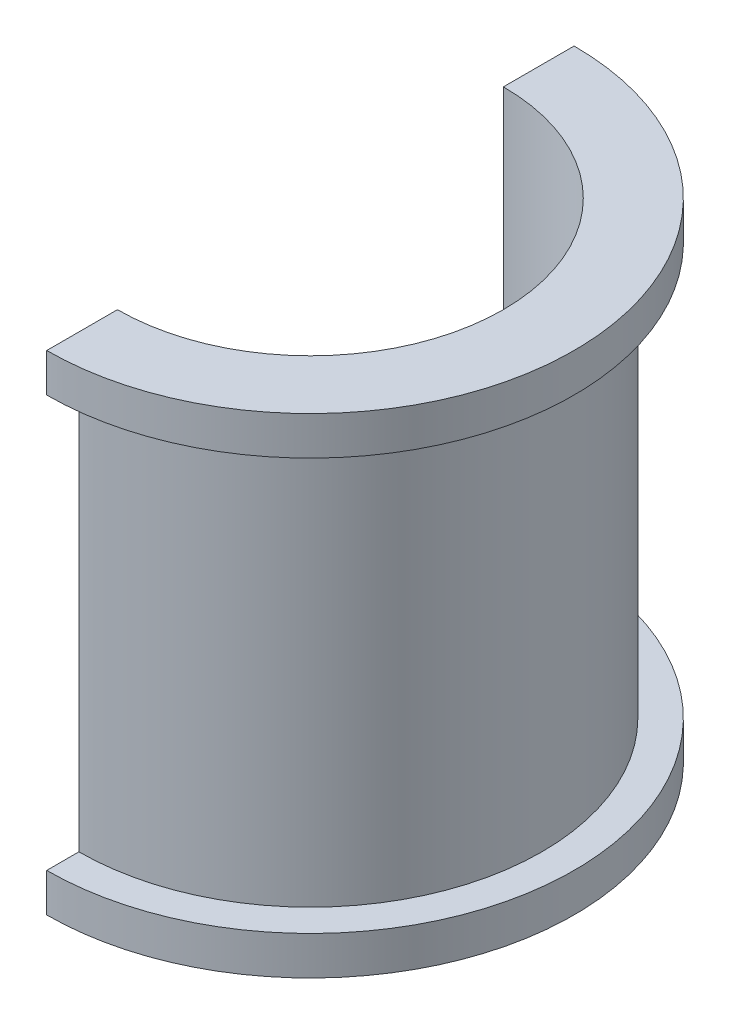
from build123d import *

# Parameters (mm, degrees)
SKETCH1_R           = 18
SKETCH1_R_2         = 15
BOSS_EXTRUDE1_DEPTH = 35
SKETCH2_R           = 20.5
SKETCH2_R_2         = 15
BOSS_EXTRUDE2_DEPTH = 3
SKETCH3_R           = 20.5
SKETCH3_R_2         = 15
BOSS_EXTRUDE3_DEPTH = 3
SKETCH2_2_R         = 20.5
SKETCH2_2_R_2       = 15
BOSS_EXTRUDE4_DEPTH = 3


with BuildPart() as part:
    # Sketch1 → Boss-Extrude1 (new body)
    with BuildSketch(Plane(origin=(0, 0, 0), x_dir=(1, 0, 0), z_dir=(0, 1, 0))):
        Circle(SKETCH1_R)
        Circle(SKETCH1_R_2, mode=Mode.SUBTRACT)
    extrude(amount=BOSS_EXTRUDE1_DEPTH)

    # Sketch2 → Boss-Extrude2 (add)
    with BuildSketch(Plane(origin=(0, 0, 0), x_dir=(1, 0, 0), z_dir=(0, 1, 0))):
        Circle(SKETCH2_R)
        Circle(SKETCH2_R_2, mode=Mode.SUBTRACT)
    extrude(amount=BOSS_EXTRUDE2_DEPTH)

    # Sketch3 → Boss-Extrude3 (add)
    with BuildSketch(Plane(origin=(0, 35, 0), x_dir=(1, 0, 0), z_dir=(0, 1, 0))):
        Circle(SKETCH3_R)
        Circle(SKETCH3_R_2, mode=Mode.SUBTRACT)
    extrude(amount=BOSS_EXTRUDE3_DEPTH)

    # Sketch2<2> → Boss-Extrude4 (add)
    with BuildSketch(Plane(origin=(0, 0, 0), x_dir=(1, 0, 0), z_dir=(0, 1, 0))):
        Circle(SKETCH2_2_R)
        Circle(SKETCH2_2_R_2, mode=Mode.SUBTRACT)
    extrude(amount=BOSS_EXTRUDE4_DEPTH)

    # Split1
    split(bisect_by=Plane(origin=(0, 0, 0), x_dir=(0, 0, 1), z_dir=(1, 0, 0)), keep=Keep.TOP)


solid = part.part
